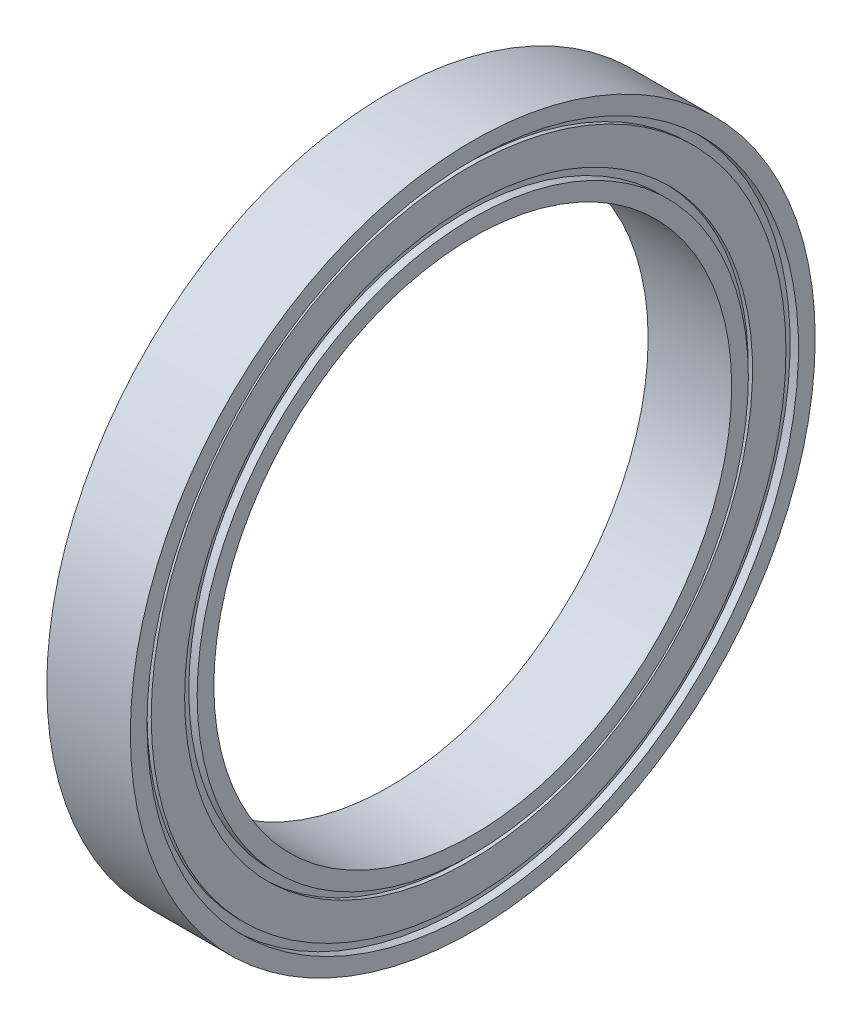
from build123d import *


with BuildPart() as part:
    # Sketch1 → Revolve1 (revolve)
    with BuildSketch(Plane.XY, mode=Mode.PRIVATE) as revolve1_sk:
        Polygon((-5, 41), (5, 41), (5, 39), (4, 39), (4, 38), (4.5, 38), (4.5, 34), (4, 34), (4, 33), (5, 33), (5, 31), (-5, 31), (-5, 33), (-4, 33), (-4, 34), (-4.5, 34), (-4.5, 38), (-4, 38), (-4, 39), (-5, 39), align=None)
    revolve(revolve1_sk.sketch.rotate(Axis((0, 0, 0), (1, 0, 0)), 90), axis=Axis((0, 0, 0), (1, 0, 0)))


solid = part.part
